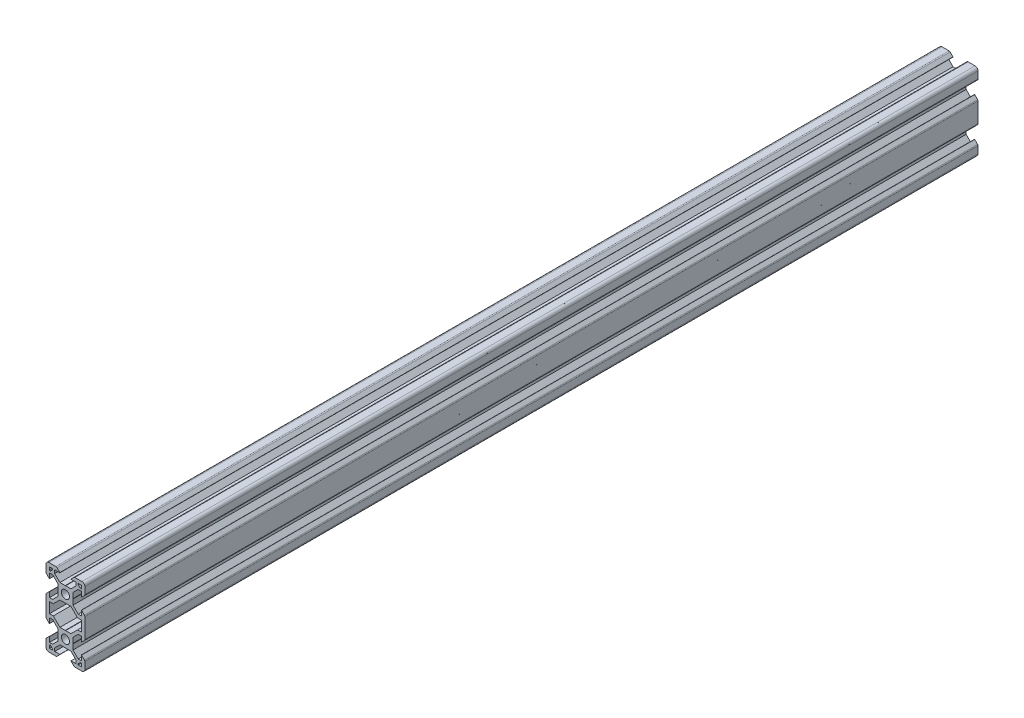
from build123d import *

# Parameters (mm, degrees)
SKETCH2_R           = 2.1
BOSS_EXTRUDE1_DEPTH = 460


with BuildPart() as part:
    # Sketch2 → Boss-Extrude1 (new body)
    with BuildSketch(Plane.XY):
        with BuildLine():
            Line((-0.1, 3.9), (0, 3.8))
            Line((0, 3.8), (0.1, 3.9))
            Line((0.1, 3.9), (2.840365134, 3.9))
            Line((2.840365134, 3.9), (5.5, 6.558825842))
            Line((5.5, 6.558825842), (5.5, 8.197505675))
            Line((5.5, 8.197505675), (2.89, 8.197505675))
            Line((2.89, 8.197505675), (2.89, 8.307505675))
            Line((2.89, 8.307505675), (4.348614357, 9.766120032))
            ThreePointArc((4.348614357, 9.766120032), (4.604908803, 9.937370505), (4.907228714, 9.997505675))
            Line((4.907228714, 9.997505675), (8.5, 9.997505675))
            ThreePointArc((8.5, 9.997505675), (9.560660172, 9.558165846), (10, 8.497505675))
            Line((10, 8.497505675), (10, 4.904734389))
            ThreePointArc((10, 4.904734389), (9.939864831, 4.602414477), (9.768614357, 4.346120032))
            Line((9.768614357, 4.346120032), (8.31, 2.887505675))
            Line((8.31, 2.887505675), (8.2, 2.887505675))
            Line((8.2, 2.887505675), (8.2, 5.497505675))
            Line((8.2, 5.497505675), (6.56, 5.497505675))
            Line((6.56, 5.497505675), (3.9, 2.83831481))
            Line((3.9, 2.83831481), (3.9, 0.1))
            Line((3.9, 0.1), (3.8, 0))
            Line((3.8, 0), (3.9, -0.1))
            Line((3.9, -0.1), (3.9, -2.84))
            Line((3.9, -2.84), (6.56, -5.5))
            Line((6.56, -5.5), (8.2, -5.5))
            Line((8.2, -5.5), (8.2, -2.89))
            Line((8.2, -2.89), (8.31, -2.89))
            Line((8.31, -2.89), (9.765685425, -4.345685425))
            ThreePointArc((9.765685425, -4.345685425), (9.939103626, -4.605224104), (10, -4.91137085))
            Line((10, -4.91137085), (10, -15.08862915))
            ThreePointArc((10, -15.08862915), (9.939103626, -15.394775896), (9.765685425, -15.654314575))
            Line((9.765685425, -15.654314575), (8.31, -17.11))
            Line((8.31, -17.11), (8.2, -17.11))
            Line((8.2, -17.11), (8.2, -14.5))
            Line((8.2, -14.5), (6.56, -14.5))
            Line((6.56, -14.5), (3.9, -17.16))
            Line((3.9, -17.16), (3.9, -19.9))
            Line((3.9, -19.9), (3.8, -20))
            Line((3.8, -20), (3.9, -20.1))
            Line((3.9, -20.1), (3.9, -22.83831481))
            Line((3.9, -22.83831481), (6.56, -25.497505675))
            Line((6.56, -25.497505675), (8.2, -25.497505675))
            Line((8.2, -25.497505675), (8.2, -22.887505675))
            Line((8.2, -22.887505675), (8.31, -22.887505675))
            Line((8.31, -22.887505675), (9.768614357, -24.346120032))
            ThreePointArc((9.768614357, -24.346120032), (9.939864831, -24.602414477), (10, -24.904734389))
            Line((10, -24.904734389), (10, -28.497505675))
            ThreePointArc((10, -28.497505675), (9.560660172, -29.558165846), (8.5, -29.997505675))
            Line((8.5, -29.997505675), (4.907228714, -29.997505675))
            ThreePointArc((4.907228714, -29.997505675), (4.604908803, -29.937370505), (4.348614357, -29.766120032))
            Line((4.348614357, -29.766120032), (2.89, -28.307505675))
            Line((2.89, -28.307505675), (2.89, -28.197505675))
            Line((2.89, -28.197505675), (5.5, -28.197505675))
            Line((5.5, -28.197505675), (5.5, -26.558825842))
            Line((5.5, -26.558825842), (2.840365134, -23.9))
            Line((2.840365134, -23.9), (0.1, -23.9))
            Line((0.1, -23.9), (0, -23.8))
            Line((0, -23.8), (-0.1, -23.9))
            Line((-0.1, -23.9), (-2.840365134, -23.9))
            Line((-2.840365134, -23.9), (-5.5, -26.558825842))
            Line((-5.5, -26.558825842), (-5.5, -28.197505675))
            Line((-5.5, -28.197505675), (-2.89, -28.197505675))
            Line((-2.89, -28.197505675), (-2.89, -28.307505675))
            Line((-2.89, -28.307505675), (-4.348614357, -29.766120032))
            ThreePointArc((-4.348614357, -29.766120032), (-4.604908803, -29.937370505), (-4.907228714, -29.997505675))
            Line((-4.907228714, -29.997505675), (-8.5, -29.997505675))
            ThreePointArc((-8.5, -29.997505675), (-9.560660172, -29.558165846), (-10, -28.497505675))
            Line((-10, -28.497505675), (-10, -24.904734389))
            ThreePointArc((-10, -24.904734389), (-9.939864831, -24.602414477), (-9.768614357, -24.346120032))
            Line((-9.768614357, -24.346120032), (-8.31, -22.887505675))
            Line((-8.31, -22.887505675), (-8.2, -22.887505675))
            Line((-8.2, -22.887505675), (-8.2, -25.497505675))
            Line((-8.2, -25.497505675), (-6.56, -25.497505675))
            Line((-6.56, -25.497505675), (-3.9, -22.83831481))
            Line((-3.9, -22.83831481), (-3.9, -20.1))
            Line((-3.9, -20.1), (-3.8, -20))
            Line((-3.8, -20), (-3.9, -19.9))
            Line((-3.9, -19.9), (-3.9, -17.16))
            Line((-3.9, -17.16), (-6.56, -14.5))
            Line((-6.56, -14.5), (-8.2, -14.5))
            Line((-8.2, -14.5), (-8.2, -17.11))
            Line((-8.2, -17.11), (-8.31, -17.11))
            Line((-8.31, -17.11), (-9.765685425, -15.654314575))
            ThreePointArc((-9.765685425, -15.654314575), (-9.939103626, -15.394775896), (-10, -15.08862915))
            Line((-10, -15.08862915), (-10, -4.91137085))
            ThreePointArc((-10, -4.91137085), (-9.939103626, -4.605224104), (-9.765685425, -4.345685425))
            Line((-9.765685425, -4.345685425), (-8.31, -2.89))
            Line((-8.31, -2.89), (-8.2, -2.89))
            Line((-8.2, -2.89), (-8.2, -5.5))
            Line((-8.2, -5.5), (-6.56, -5.5))
            Line((-6.56, -5.5), (-3.9, -2.84))
            Line((-3.9, -2.84), (-3.9, -0.1))
            Line((-3.9, -0.1), (-3.8, 0))
            Line((-3.8, 0), (-3.9, 0.1))
            Line((-3.9, 0.1), (-3.9, 2.83831481))
            Line((-3.9, 2.83831481), (-6.56, 5.497505675))
            Line((-6.56, 5.497505675), (-8.2, 5.497505675))
            Line((-8.2, 5.497505675), (-8.2, 2.887505675))
            Line((-8.2, 2.887505675), (-8.31, 2.887505675))
            Line((-8.31, 2.887505675), (-9.768614357, 4.346120032))
            ThreePointArc((-9.768614357, 4.346120032), (-9.939864831, 4.602414477), (-10, 4.904734389))
            Line((-10, 4.904734389), (-10, 8.497505675))
            ThreePointArc((-10, 8.497505675), (-9.560660172, 9.558165846), (-8.5, 9.997505675))
            Line((-8.5, 9.997505675), (-4.907228714, 9.997505675))
            ThreePointArc((-4.907228714, 9.997505675), (-4.604908803, 9.937370505), (-4.348614357, 9.766120032))
            Line((-4.348614357, 9.766120032), (-2.89, 8.307505675))
            Line((-2.89, 8.307505675), (-2.89, 8.197505675))
            Line((-2.89, 8.197505675), (-5.5, 8.197505675))
            Line((-5.5, 8.197505675), (-5.5, 6.558825842))
            Line((-5.5, 6.558825842), (-2.840365134, 3.9))
            Line((-2.840365134, 3.9), (-0.1, 3.9))
        make_face()
        Circle(SKETCH2_R, mode=Mode.SUBTRACT)
        with Locations(Location((0, -20, 0), (0, 0, 180))):
            Circle(SKETCH2_R, mode=Mode.SUBTRACT)
        Polygon((-7.66, 6.567505675), (-6.57, 7.657505675), (-6.57, 8.197505675), (-8.2, 8.197505675), (-8.2, 6.567505675), align=None, mode=Mode.SUBTRACT)
        Polygon((-0.1, -3.9), (0, -3.8), (0.1, -3.9), (2.840365134, -3.9), (6.24, -7.299634866), (8.2, -7.299634866), (8.2, -12.700365134), (6.24, -12.700365134), (2.840365134, -16.1), (0.1, -16.1), (0, -16.2), (-0.1, -16.1), (-2.840365134, -16.1), (-6.24, -12.700365134), (-8.2, -12.700365134), (-8.2, -7.299634866), (-6.24, -7.299634866), (-2.840365134, -3.9), align=None, mode=Mode.SUBTRACT)
        Polygon((8.2, 6.567505675), (7.66, 6.567505675), (6.57, 7.657505675), (6.57, 8.197505675), (8.2, 8.197505675), align=None, mode=Mode.SUBTRACT)
        Polygon((7.66, -26.567505675), (6.57, -27.657505675), (6.57, -28.197505675), (8.2, -28.197505675), (8.2, -26.567505675), align=None, mode=Mode.SUBTRACT)
        Polygon((-8.2, -26.567505675), (-7.66, -26.567505675), (-6.57, -27.657505675), (-6.57, -28.197505675), (-8.2, -28.197505675), align=None, mode=Mode.SUBTRACT)
    extrude(amount=-BOSS_EXTRUDE1_DEPTH)


solid = part.part
